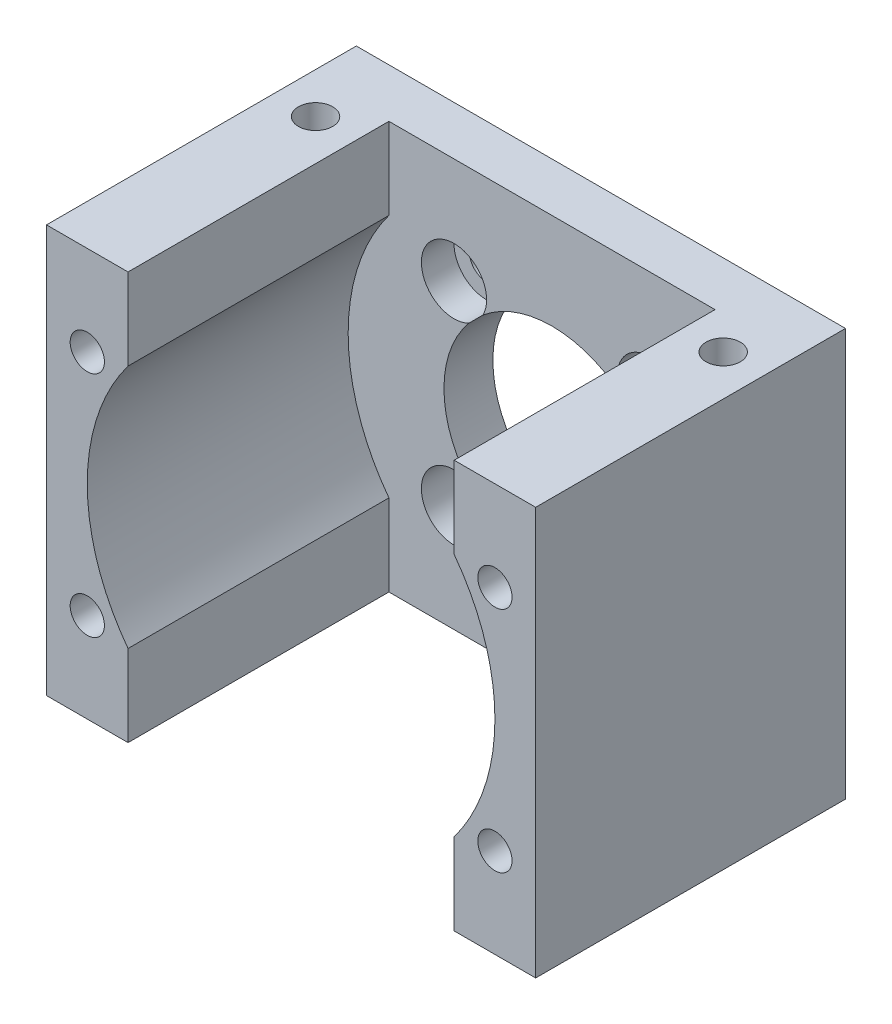
from build123d import *

# Parameters (mm, degrees)
SKETCH_1_W                  = 60
SKETCH_1_H                  = 50
EXTRUDE_1_DEPTH             = 38
SKETCH_2_W                  = 40
SKETCH_2_H                  = 67.456297037
CUT_EXTRUDE_1_DEPTH         = 70.598850565
SKETCH_3_R                  = 25
CUT_EXTRUDE_2_DEPTH         = 32
SKETCH_4_R                  = 13.25
CUT_EXTRUDE_3_DEPTH         = 10
HOLE_WIZARD_4_2_4_2_1_D     = 4.2
HOLE_WIZARD_M5_2_AT_2_COUNT = 2
HOLE_WIZARD_M5_2_AT_2_PITCH = 50
SKETCH_11_R                 = 4
CUT_EXTRUDE_4_DEPTH         = 4
PATTERN_CIRCULAR_1_COUNT    = 4


with BuildPart() as part:
    # 草图1 → 凸台-拉伸1 (new body)
    with BuildSketch(Plane.XY):
        Rectangle(SKETCH_1_W, SKETCH_1_H)
    extrude(amount=EXTRUDE_1_DEPTH)

    # 草图2 → 切除-拉伸1 (cut, through all)
    with BuildSketch(Plane(origin=(0, 25, 0), x_dir=(1, 0, 0), z_dir=(0, 1, 0))):
        with Locations((0, -39.728148518)):
            Rectangle(SKETCH_2_W, SKETCH_2_H)
    extrude(amount=-CUT_EXTRUDE_1_DEPTH, mode=Mode.SUBTRACT)

    # 草图3 → 切除-拉伸2 (cut)
    with BuildSketch(Plane.XY.offset(38)):
        Circle(SKETCH_3_R)
    extrude(amount=-CUT_EXTRUDE_2_DEPTH, mode=Mode.SUBTRACT)

    # 草图4 → 切除-拉伸3 (cut)
    with BuildSketch(Plane(origin=(0, 0, 0), x_dir=(-1, 0, 0), z_dir=(0, 0, -1))):
        Circle(SKETCH_4_R)
    extrude(amount=-CUT_EXTRUDE_3_DEPTH, mode=Mode.SUBTRACT)

    # Ø4.2 (4.2) 直径孔1 (through all)
    with Locations(Plane.XY.offset(6)):
        with Locations((12.02081528, 12.02081528), (-12.02081528, 12.02081528), (-12.02081528, -12.02081528), (12.02081528, -12.02081528)):
            Hole(HOLE_WIZARD_4_2_4_2_1_D / 2)

    # 草图7 → M5 螺纹孔1 (revolve, cut)
    with BuildSketch(Plane(origin=(25, 14, 38), x_dir=(0, -1, 0), z_dir=(1, 0, 0))):
        Polygon((0, 0), (0, 23.6618073), (2.1, 22.4), (2.1, 0), align=None)
    hole_wizard_m5_1 = revolve(axis=Axis((25, 14, 44.35), (0, 0, -1)), mode=Mode.SUBTRACT)

    # 镜向1: M5 螺纹孔1 across plane
    add(hole_wizard_m5_1.mirror(Plane.ZX), mode=Mode.SUBTRACT)

    # 镜向2: M5 螺纹孔1 across plane
    add(hole_wizard_m5_1.mirror(Plane.ZY), mode=Mode.SUBTRACT)

    # 镜向2 copy 1 sketch → 镜向2 copy 1 (revolve, cut)
    with BuildSketch(Plane(origin=(-25, -14, 38), x_dir=(0, 1, 0), z_dir=(-1, 0, 0))):
        Polygon((0, 0), (0, 23.6618073), (2.1, 22.4), (2.1, 0), align=None)
    revolve(axis=Axis((-25, -14, 44.35), (0, 0, -1)), mode=Mode.SUBTRACT)

    # 草图9 → M5 螺纹孔2 (revolve, cut)
    with BuildSketch(Plane(origin=(-25, 25, 10), x_dir=(0, 0, 1), z_dir=(1, 0, 0))):
        Polygon((0, 0), (0, 13.6618073), (2.1, 12.4), (2.1, 0), align=None)
    hole_wizard_m5_2 = revolve(axis=Axis((-25, 31.35, 10), (0, -1, 0)), mode=Mode.SUBTRACT)

    # M5 螺纹孔2 at 2: M5 螺纹孔2 ×2
    with Locations(*[(i * HOLE_WIZARD_M5_2_AT_2_PITCH, 0, 0) for i in range(1, HOLE_WIZARD_M5_2_AT_2_COUNT)]):
        add(hole_wizard_m5_2, mode=Mode.SUBTRACT)

    # 镜向3: M5 螺纹孔2 across plane
    add(hole_wizard_m5_2.mirror(Plane.ZX), mode=Mode.SUBTRACT)

    # 镜向3 copy 1 sketch → 镜向3 copy 1 (revolve, cut)
    with BuildSketch(Plane(origin=(25, -25, 10), x_dir=(0, 0, 1), z_dir=(1, 0, 0))):
        Polygon((0, 0), (0, -13.6618073), (2.1, -12.4), (2.1, 0), align=None)
    revolve(axis=Axis((25, -31.35, 10), (0, -1, 0)), mode=Mode.SUBTRACT)

    # 草图11 → 切除-拉伸4 (cut)
    with BuildSketch(Plane.XY.offset(6)):
        with Locations((12.02081528, 12.02081528)):
            Circle(SKETCH_11_R)
    cut_extrude_4 = extrude(amount=-CUT_EXTRUDE_4_DEPTH, mode=Mode.SUBTRACT)

    # 阵列(圆周)1: 切除-拉伸4 ×4 about axis
    pattern_circular_1_axis = Axis((0, 0, 0), (0, 0, 1))
    for i in range(1, PATTERN_CIRCULAR_1_COUNT):
        add(cut_extrude_4.rotate(pattern_circular_1_axis, i * 360 / PATTERN_CIRCULAR_1_COUNT), mode=Mode.SUBTRACT)


solid = part.part
